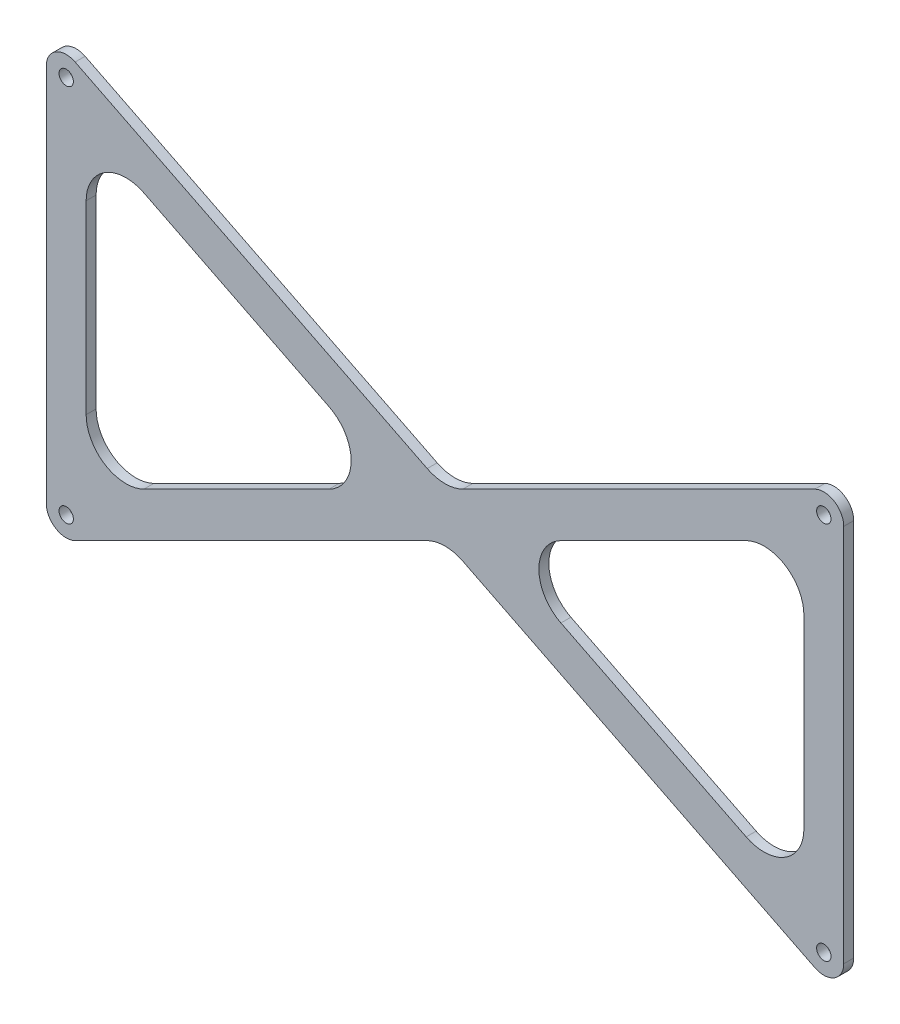
from build123d import *

# Parameters (mm, degrees)
BOSS_EXTRUDE1_DEPTH = 3.175
SKETCH2_R           = 2.286
CUT_EXTRUDE1_DEPTH  = 144.473468802
FILLET1_R           = 12.7


with BuildPart() as part:
    # Sketch1 → Boss-Extrude1 (new body)
    with BuildSketch(Plane.XY):
        with BuildLine():
            Line((-117.810193669, -66.004612663), (0, -7.099515829))
            Line((0, -7.099515829), (117.810193669, -66.004612663))
            ThreePointArc((117.810193669, -66.004612663), (123.988392562, -65.726632633), (127, -60.325))
            Line((127, -60.325), (127, 60.325))
            ThreePointArc((127, 60.325), (123.988392562, 65.726632633), (117.810193669, 66.004612663))
            Line((117.810193669, 66.004612663), (0, 7.099515829))
            Line((0, 7.099515829), (-117.810193669, 66.004612663))
            ThreePointArc((-117.810193669, 66.004612663), (-123.988392562, 65.726632633), (-127, 60.325))
            Line((-127, 60.325), (-127, -60.325))
            ThreePointArc((-127, -60.325), (-123.988392562, -65.726632633), (-117.810193669, -66.004612663))
        make_face()
        Polygon((-114.3, -50.050484171), (-14.199031657, 0), (-114.3, 50.050484171), align=None, mode=Mode.SUBTRACT)
        Polygon((14.199031657, 0), (114.3, 50.050484171), (114.3, -50.050484171), align=None, mode=Mode.SUBTRACT)
    extrude(amount=BOSS_EXTRUDE1_DEPTH)

    # Sketch2 → Cut-Extrude1 (cut, through all)
    with BuildSketch(Plane.XY.offset(3.175)):
        with Locations((-120.65, 60.325)):
            Circle(SKETCH2_R)
        with Locations((-120.65, -60.325)):
            Circle(SKETCH2_R)
        with Locations((120.65, -60.325)):
            Circle(SKETCH2_R)
        with Locations((120.65, 60.325)):
            Circle(SKETCH2_R)
    extrude(amount=-CUT_EXTRUDE1_DEPTH, mode=Mode.SUBTRACT)

    # Fillet1
    fillet1_edges = [part.edges().sort_by_distance(p)[0] for p in [
        (0, -7.099515829, 1.5875),
        (0, 7.099515829, 1.5875),
        (114.3, -50.050484171, 1.5875),
        (114.3, 50.050484171, 1.5875),
        (14.199031657, 0, 1.5875),
        (-14.199031657, 0, 1.5875),
        (-114.3, 50.050484171, 1.5875),
        (-114.3, -50.050484171, 1.5875),
    ]]
    fillet(fillet1_edges, radius=FILLET1_R)


solid = part.part
